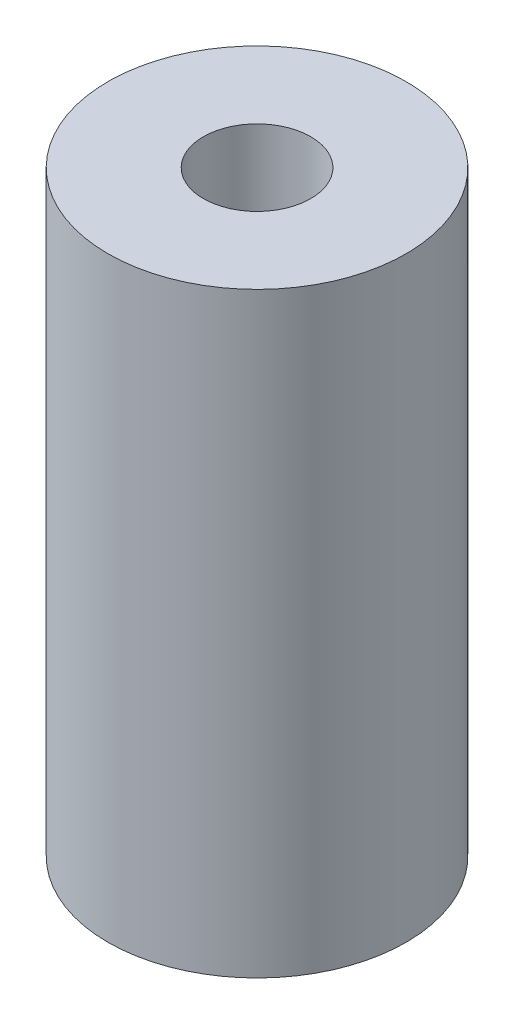
from build123d import *

# Parameters (mm, degrees)
SKETCH1_R           = 3.175
BOSS_EXTRUDE3_DEPTH = 12.7
SKETCH2_R           = 1.143
CUT_EXTRUDE1_DEPTH  = 12.7


with BuildPart() as part:
    # Sketch1 → Boss-Extrude3 (new body)
    with BuildSketch(Plane(origin=(0, 0, 0), x_dir=(1, 0, 0), z_dir=(0, 1, 0))):
        with Locations(Location((0, 0, 0), (0, 0, 270))):
            Circle(SKETCH1_R)
    extrude(amount=BOSS_EXTRUDE3_DEPTH)

    # Sketch2 → Cut-Extrude1 (cut)
    with BuildSketch(Plane(origin=(0, 0, 0), x_dir=(-1, 0, 0), z_dir=(0, -1, 0))):
        with Locations(Location((0, 0, 0), (0, 0, 90))):
            Circle(SKETCH2_R)
    extrude(amount=-CUT_EXTRUDE1_DEPTH, mode=Mode.SUBTRACT)


solid = part.part
